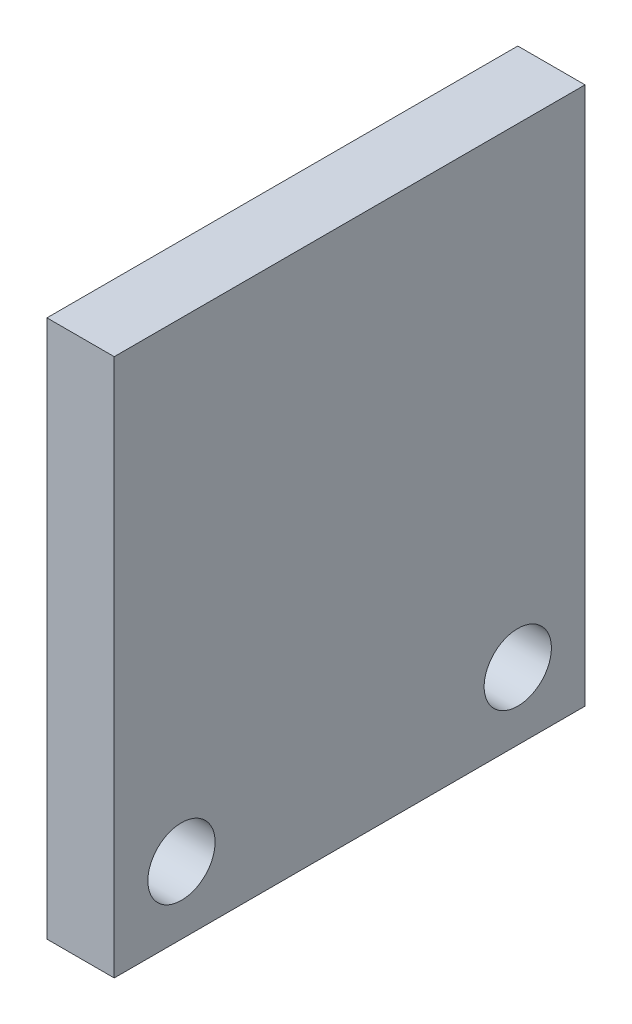
from build123d import *

# Parameters (mm, degrees)
SKETCH1_W           = 35
SKETCH1_H           = 40
BOSS_EXTRUDE1_DEPTH = 5
SKETCH2_R           = 2.5
CUT_EXTRUDE1_DEPTH  = 28.041634566


with BuildPart() as part:
    # Sketch1 → Boss-Extrude1 (new body)
    with BuildSketch(Plane(origin=(0, 0, 0), x_dir=(0, 0, -1), z_dir=(1, 0, 0))):
        Rectangle(SKETCH1_W, SKETCH1_H)
    extrude(amount=BOSS_EXTRUDE1_DEPTH)

    # Sketch2 → Cut-Extrude1 (cut, through all)
    with BuildSketch(Plane(origin=(5, 0, 0), x_dir=(0, 0, -1), z_dir=(1, 0, 0))):
        with Locations((-12.5, -15)):
            Circle(SKETCH2_R)
        with Locations((12.5, -15)):
            Circle(SKETCH2_R)
    extrude(amount=-CUT_EXTRUDE1_DEPTH, mode=Mode.SUBTRACT)


solid = part.part
